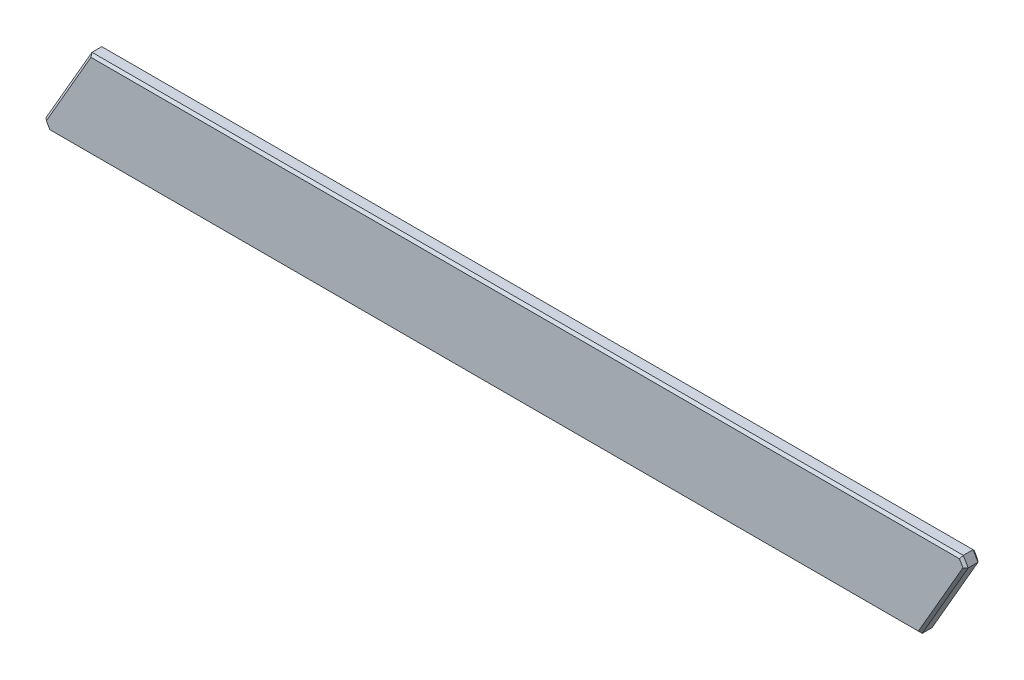
from build123d import *

# Parameters (mm, degrees)
EXTRUDE_1_DEPTH = 3
CHAMFER_1_SIZE  = 0.5


with BuildPart() as part:
    # 草图1 → 凸台-拉伸1 (new body)
    with BuildSketch(Plane.XY):
        Polygon((84.803847577, -9), (-93.196152423, -9), (-94.196152423, -7.267949192), (-84.803847577, 9), (93.196152423, 9), (94.196152423, 7.267949192), align=None)
    extrude(amount=EXTRUDE_1_DEPTH)

    # 倒角1
    chamfer_1_edges = [part.edges().sort_by_distance(p)[0] for p in [
        (4.196152423, 9, 3),
        (-89.5, 0.866025404, 3),
        (-93.696152423, -8.133974596, 3),
        (-4.196152423, -9, 3),
        (89.5, -0.866025404, 3),
        (-4.196152423, -9, 0),
        (-93.696152423, -8.133974596, 0),
        (-89.5, 0.866025404, 0),
        (4.196152423, 9, 0),
        (93.696152423, 8.133974596, 0),
        (89.5, -0.866025404, 0),
        (93.696152423, 8.133974596, 3),
    ]]
    chamfer(chamfer_1_edges, length=CHAMFER_1_SIZE)


solid = part.part
